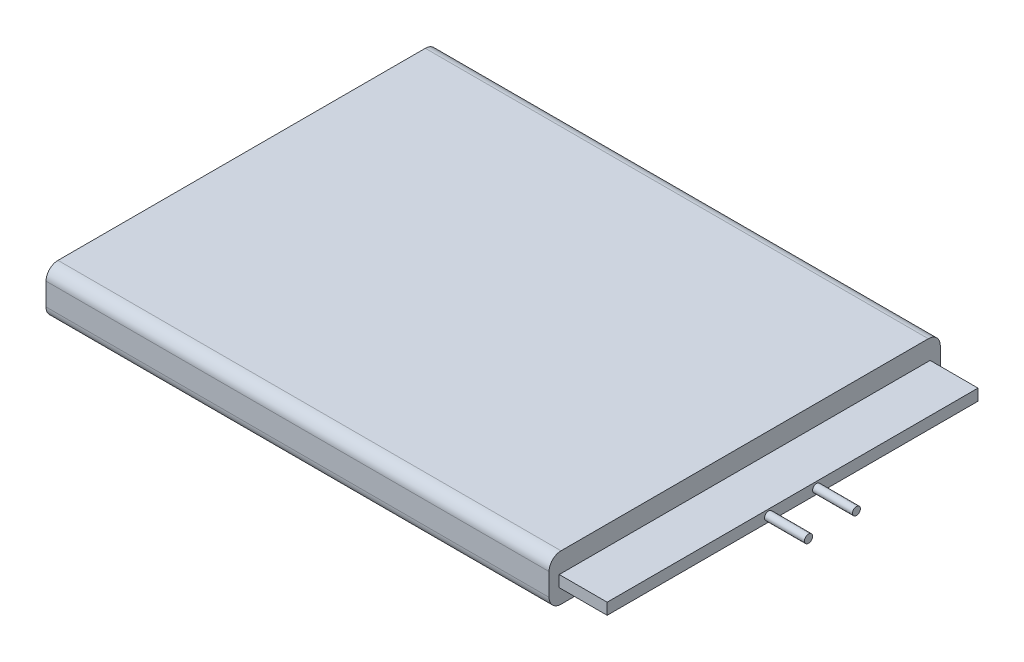
from build123d import *

# Parameters (mm, degrees)
CROQUIS1_W              = 63
CROQUIS1_H              = 49
SALIENTE_EXTRUIR1_DEPTH = 5.8
REDONDEO1_R             = 1.5
CROQUIS2_W              = 46.443628054
CROQUIS2_H              = 1.426596084
SALIENTE_EXTRUIR2_DEPTH = 6
CROQUIS3_R              = 0.510026017
CROQUIS3_R_2            = 0.496056104
SALIENTE_EXTRUIR3_DEPTH = 5


with BuildPart() as part:
    # Croquis1 → Saliente-Extruir1 (new body)
    with BuildSketch(Plane(origin=(0, 0, 0), x_dir=(1, 0, 0), z_dir=(0, 1, 0))):
        with Locations((31.5, 24.5)):
            Rectangle(CROQUIS1_W, CROQUIS1_H)
    extrude(amount=SALIENTE_EXTRUIR1_DEPTH)

    # Redondeo1
    redondeo1_edges = [part.edges().sort_by_distance(p)[0] for p in [
        (31.5, 5.8, -49),
        (31.5, 0, -49),
        (31.5, 0, 0),
        (31.5, 5.8, 0),
    ]]
    fillet(redondeo1_edges, radius=REDONDEO1_R)

    # Croquis2 → Saliente-Extruir2 (add)
    with BuildSketch(Plane(origin=(63, 0, 0), x_dir=(0, 0, -1), z_dir=(1, 0, 0))):
        with Locations((24.5, 2.622606317)):
            Rectangle(CROQUIS2_W, CROQUIS2_H)
    extrude(amount=SALIENTE_EXTRUIR2_DEPTH)

    # Croquis3 → Saliente-Extruir3 (add)
    with BuildSketch(Plane(origin=(69, 0, 0), x_dir=(0, 0, -1), z_dir=(1, 0, 0))):
        with Locations((21.5, 2.616385566)):
            Circle(CROQUIS3_R)
        with Locations((27.5, 2.616385566)):
            Circle(CROQUIS3_R_2)
    extrude(amount=SALIENTE_EXTRUIR3_DEPTH)


solid = part.part
